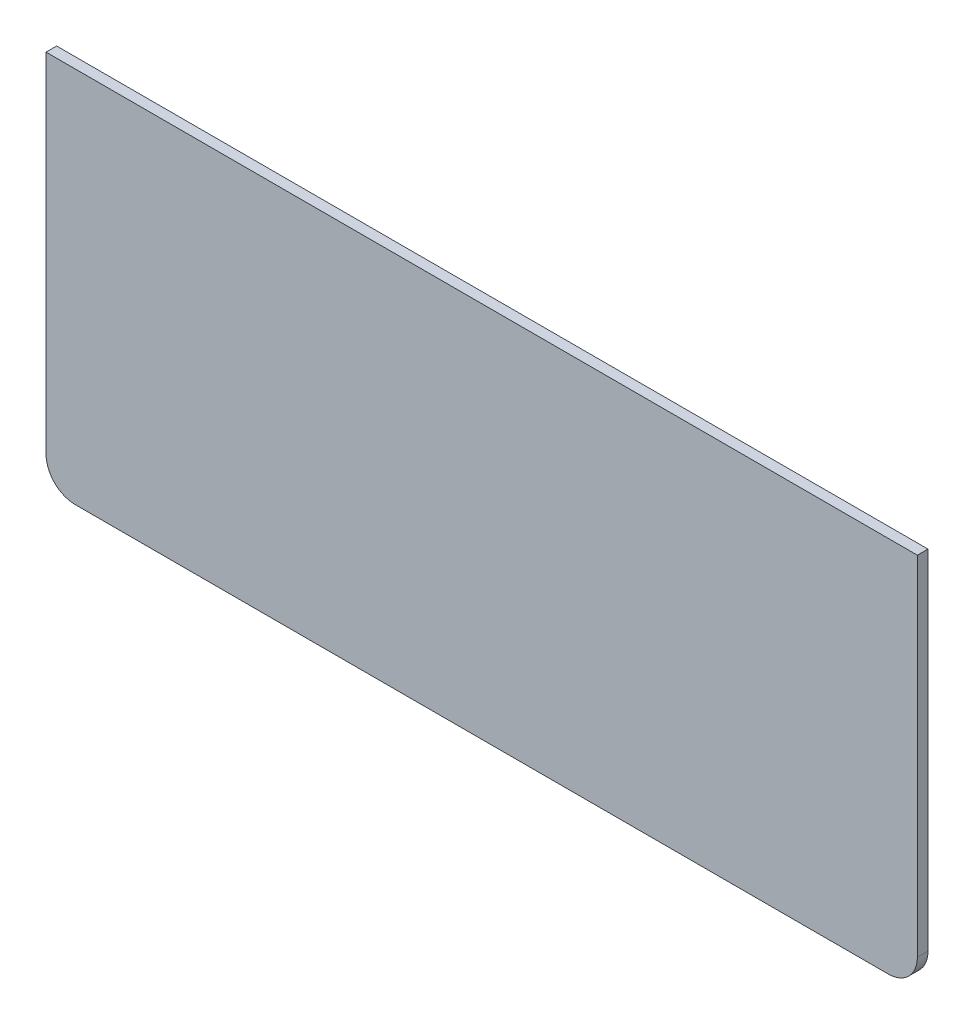
from build123d import *

# Parameters (mm, degrees)
SKETCH2_W           = 261.35
SKETCH2_H           = 113.175
BOSS_EXTRUDE1_DEPTH = 3.175
FILLET1_R           = 8.73125


with BuildPart() as part:
    # Sketch2 → Boss-Extrude1 (new body)
    with BuildSketch(Plane.XY):
        with Locations((77.088397155, -16.051971223)):
            Rectangle(SKETCH2_W, SKETCH2_H)
    extrude(amount=BOSS_EXTRUDE1_DEPTH)

    # Fillet1
    fillet1_edges = [part.edges().sort_by_distance(p)[0] for p in [
        (207.763397155, -72.639471223, 1.5875),
        (-53.586602845, -72.639471223, 1.5875),
    ]]
    fillet(fillet1_edges, radius=FILLET1_R)


solid = part.part
